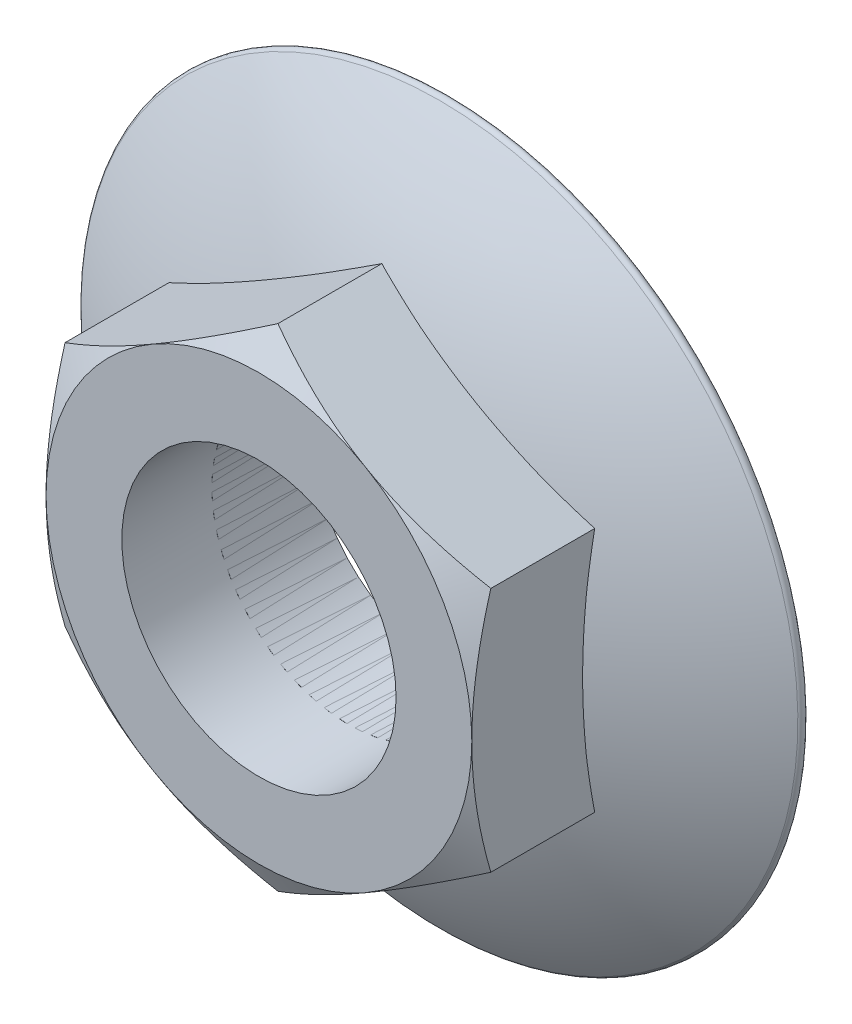
from build123d import *

# Parameters (mm, degrees)
BOSS_EXTRUDE1_DEPTH = 20
SKETCH3_OUTSIDE_W   = 169.436
SKETCH3_OUTSIDE_H   = 169.436
SKETCH3_OUTSIDE_R   = 22.5
CUT_EXTRUDE1_DEPTH  = 20
CUT_EXTRUDE1_DRAFT  = -60
SKETCH4_R           = 14.493939327
CUT_EXTRUDE3_DEPTH  = 58.491490699


with BuildPart() as part:
    # Sketch1 → Boss-Extrude1 (new body)
    with BuildSketch(Plane.XY):
        Polygon((22.5, -12.990381057), (22.5, 12.990381057), (0, 25.980762114), (-22.5, 12.990381057), (-22.5, -12.990381057), (0, -25.980762114), align=None)
    extrude(amount=BOSS_EXTRUDE1_DEPTH)


with BuildPart() as body_2:
    # Sketch2 → Revolve2 (revolve)
    with BuildSketch(Plane(origin=(0, 0, 0), x_dir=(0, 0, -1), z_dir=(1, 0, 0)), mode=Mode.PRIVATE) as revolve2_sk:
        with BuildLine():
            Line((0, 0), (-12, 0))
            ThreePointArc((-12, 0), (-9.173487396, -19.734811075), (-0.921212278, -37.882865986))
            ThreePointArc((-0.921212278, -37.882865986), (-0.359654246, -38.093357847), (0, -37.613458827))
            Line((0, -37.613458827), (0, 0))
        make_face()
    revolve(revolve2_sk.sketch.rotate(Axis((0, 0, 0), (0, 0, 1)), 180), axis=Axis((0, 0, 0), (0, 0, 1)))


with BuildPart() as cut_extrude1_tool:
    # Sketch3 outside → Cut-Extrude1 (with draft: the straight prism first)
    with BuildSketch(Plane.XY.offset(20)):
        Rectangle(SKETCH3_OUTSIDE_W, SKETCH3_OUTSIDE_H)
        Circle(SKETCH3_OUTSIDE_R, mode=Mode.SUBTRACT)
    extrude(amount=-CUT_EXTRUDE1_DEPTH)
    # Cut-Extrude1: the draft: its side faces are tilted about the plane it starts from
    cut_extrude1_sides = [cut_extrude1_tool.faces().sort_by_distance(p)[0] for p in [
        (0, -84.718, 10),
        (84.718, 0, 10),
        (0, 84.718, 10),
        (-84.718, 0, 10),
        (-22.5, 0, 10),
    ]]
    draft(cut_extrude1_sides, Plane.XY.offset(20), CUT_EXTRUDE1_DRAFT)


with BuildPart() as part_1:
    add(part.part)

    # Cut-Extrude1: cut by cut_extrude1_tool
    add(cut_extrude1_tool.part, mode=Mode.SUBTRACT)


with BuildPart() as cut_extrude3_tool:
    # Sketch4 → Cut-Extrude3 (new, through all)
    with BuildSketch(Plane.XY.offset(20)):
        Circle(SKETCH4_R)
    extrude(amount=-CUT_EXTRUDE3_DEPTH)


with BuildPart() as part_2:
    add(part_1.part)

    # Cut-Extrude3: cut by cut_extrude3_tool
    add(cut_extrude3_tool.part, mode=Mode.SUBTRACT)


with BuildPart() as body_2_1:
    add(body_2.part)

    # Cut-Extrude3: cut by cut_extrude3_tool
    add(cut_extrude3_tool.part, mode=Mode.SUBTRACT)


solid = Compound([part_2.part, body_2_1.part])
